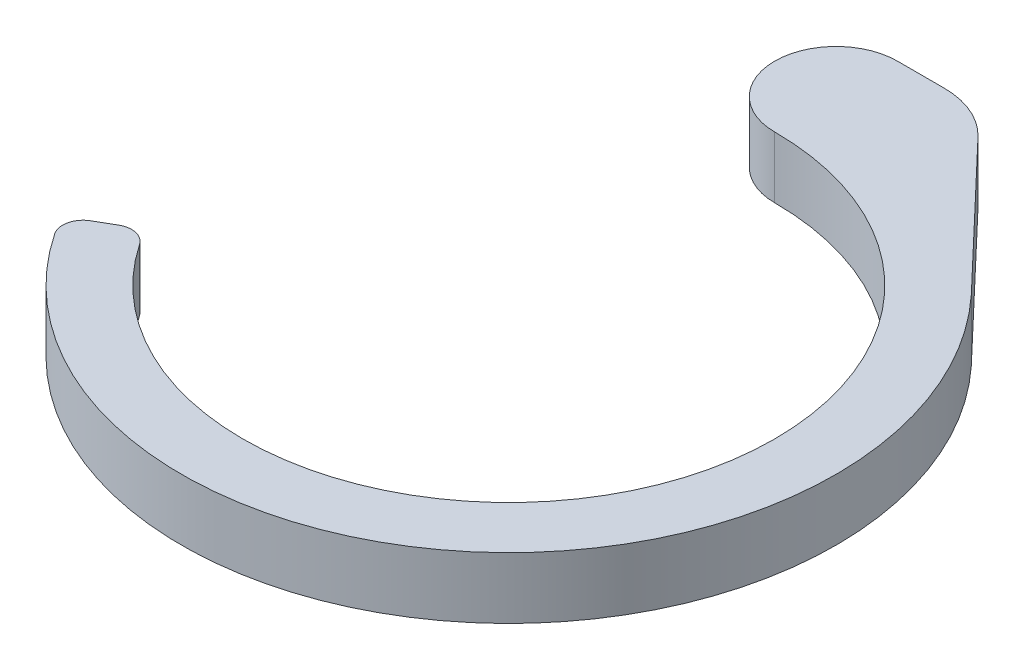
from build123d import *

# Parameters (mm, degrees)
EXTRUDE_4_DEPTH = 15


with BuildPart() as part:
    # ｽｹｯﾁ2 → ﾎﾞｽ - 押し出し4 (new body)
    with BuildSketch(Plane(origin=(0, 0, 0), x_dir=(1, 0, 0), z_dir=(0, 1, 0))):
        with BuildLine():
            ThreePointArc((-53.82643789, -36.437818048), (-56.846261527, -34.367935813), (-60.466933112, -34.910600109))
            Line((-60.466933112, -34.910600109), (-64.807406984, -37.416573868))
            ThreePointArc((-64.807406984, -37.416573868), (-67.177509772, -40.614402853), (-66.461234116, -44.529814279))
            ThreePointArc((-66.461234116, -44.529814279), (49.665387485, -62.716419588), (58.57572973, 54.487465409))
            Line((58.57572973, 54.487465409), (57.289371136, 55.838409315))
            Line((57.289371136, 55.838409315), (25.911523347, 88.791671712))
            ThreePointArc((25.911523347, 88.791671712), (19.306695871, 93.382511176), (11.427401304, 95))
            Line((11.427401304, 95), (0, 95))
            ThreePointArc((0, 95), (-15, 80), (0, 65))
            ThreePointArc((0, 65), (57.41714976, -30.467538684), (-53.82643789, -36.437818048))
        make_face()
    extrude(amount=EXTRUDE_4_DEPTH)


solid = part.part
